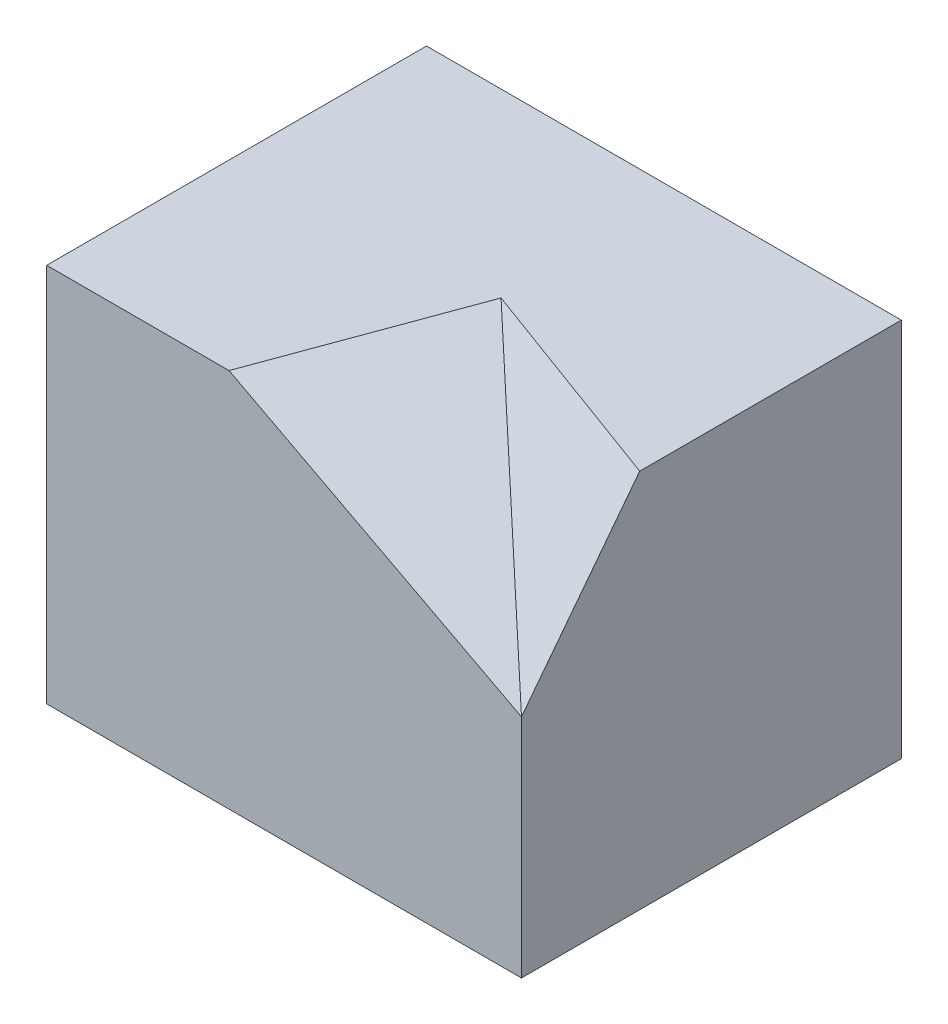
from build123d import *

# Parameters (mm, degrees)
SKETCH1_W           = 1270
SKETCH1_H           = 1016
BOSS_EXTRUDE1_DEPTH = 1016


with BuildPart() as part:
    # Sketch1 → Boss-Extrude1 (new body)
    with BuildSketch(Plane(origin=(0, 0, 0), x_dir=(1, 0, 0), z_dir=(0, 1, 0))):
        with Locations((635, 508)):
            Rectangle(SKETCH1_W, SKETCH1_H)
    extrude(amount=BOSS_EXTRUDE1_DEPTH)

    # Sketch2 → Cut-Loft3 section 0
    with BuildSketch(Plane(origin=(0, 1016, 0), x_dir=(1, 0, 0), z_dir=(0, 1, 0)), mode=Mode.PRIVATE) as cut_loft3_s0:
        with BuildLine():
            Line((487.697722316, 0), (683.341932375, 532.014117673))
            Line((683.341932375, 532.014117673), (1270, 316.275003987))
            Line((1270, 316.275003987), (1270, 0))
            Line((1270, 0), (487.697722316, 0))
        make_face()
    loft([cut_loft3_s0.sketch, Vertex(1270, 605.056510384, 0)], mode=Mode.SUBTRACT)


solid = part.part
